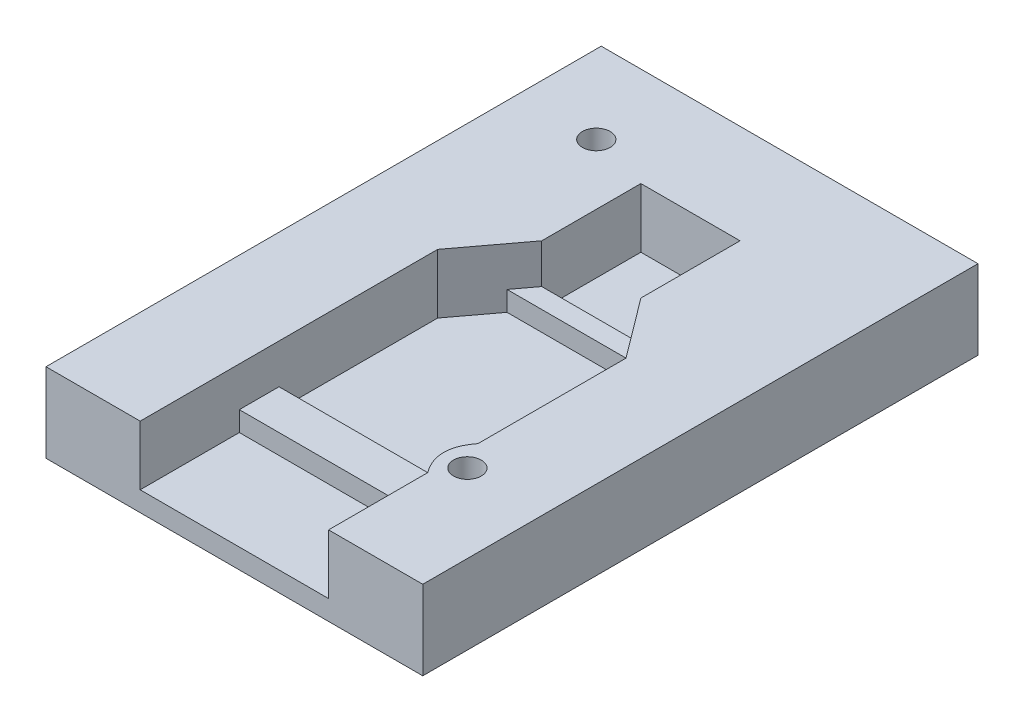
from build123d import *

# Parameters (mm, degrees)
SKETCH1_W           = 13.5
SKETCH1_H           = 20
BOSS_EXTRUDE1_DEPTH = 1
BOSS_EXTRUDE2_DEPTH = 3
BOSS_EXTRUDE3_DEPTH = 1
CUT_EXTRUDE1_START  = -1
SKETCH4_R           = 0.7
CUT_EXTRUDE1_DEPTH  = 11.5
SKETCH5_W           = 9.5
SKETCH5_H           = 2
BOSS_EXTRUDE4_DEPTH = 1
SKETCH6_W           = 19
SKETCH6_H           = 28
SKETCH6_W_2         = 13.5
SKETCH6_H_2         = 20
BOSS_EXTRUDE5_DEPTH = 1
BOSS_EXTRUDE6_DEPTH = 3


with BuildPart() as part:
    # Sketch1 → Boss-Extrude1 (new body)
    with BuildSketch(Plane(origin=(0, 0, 0), x_dir=(1, 0, 0), z_dir=(0, 1, 0))):
        with Locations((6.75, 10)):
            Rectangle(SKETCH1_W, SKETCH1_H)
    extrude(amount=BOSS_EXTRUDE1_DEPTH)

    # Sketch2 → Boss-Extrude2 (add)
    with BuildSketch(Plane(origin=(0, 1, 0), x_dir=(1, 0, 0), z_dir=(0, 1, 0))):
        with BuildLine():
            Line((2, 10), (2, 2))
            Line((2, 2), (2, 0))
            Line((2, 0), (0, 0))
            Line((0, 0), (0, 20))
            Line((0, 20), (13.5, 20))
            Line((13.5, 20), (13.5, 0))
            Line((13.5, 0), (11.5, 0))
            add(Edge.make_bspline(
                [(11.5, 2.535585729), (10.536627545, 1.300187459), (11.5, 0)],
                knots=[0, 0, 0, 1, 1, 1], degree=2))
            Line((11.5, 2.535585729), (11.5, 10))
            Line((11.5, 10), (9.25, 13))
            Line((9.25, 13), (9.25, 18))
            Line((9.25, 18), (4.25, 18))
            Line((4.25, 18), (4.25, 13))
            Line((4.25, 13), (2, 10))
        make_face()
    extrude(amount=BOSS_EXTRUDE2_DEPTH)

    # Sketch3 → Boss-Extrude3 (add)
    with BuildSketch(Plane(origin=(0, 1, 0), x_dir=(1, 0, 0), z_dir=(0, 1, 0))):
        Polygon((4.25, 13), (9.25, 13), (10, 12), (3.5, 12), align=None)
    extrude(amount=BOSS_EXTRUDE3_DEPTH)

    # Sketch4 → Cut-Extrude1 (cut)
    with BuildSketch(Plane.XZ.offset(CUT_EXTRUDE1_START)):
        with Locations(Location((1.2, -18.8, 0), (0, 0, 270))):
            Circle(SKETCH4_R)
        with Locations(Location((12.3, -1.2, 0), (0, 0, 270))):
            Circle(SKETCH4_R)
    extrude(amount=-CUT_EXTRUDE1_DEPTH, mode=Mode.SUBTRACT)

    # Sketch5 → Boss-Extrude4 (add)
    with BuildSketch(Plane(origin=(0, 1, 0), x_dir=(1, 0, 0), z_dir=(0, 1, 0))):
        with Locations((6.75, 1)):
            Rectangle(SKETCH5_W, SKETCH5_H)
    extrude(amount=BOSS_EXTRUDE4_DEPTH)

    # Sketch6 → Boss-Extrude5 (add)
    with BuildSketch(Plane(origin=(0, 1, 0), x_dir=(1, 0, 0), z_dir=(0, 1, 0))):
        with Locations((6.75, 9)):
            Rectangle(SKETCH6_W, SKETCH6_H)
        with Locations((6.75, 10)):
            Rectangle(SKETCH6_W_2, SKETCH6_H_2, mode=Mode.SUBTRACT)
    extrude(amount=-BOSS_EXTRUDE5_DEPTH)

    # Sketch7 → Boss-Extrude6 (add)
    with BuildSketch(Plane(origin=(0, 4, 0), x_dir=(1, 0, 0), z_dir=(0, 1, 0))):
        Polygon((2, 0), (2, -5), (-2.75, -5), (-2.75, 23), (16.25, 23), (16.25, -5), (11.5, -5), (11.5, 0), (13.5, 0), (13.5, 20), (0, 20), (0, 0), align=None)
    extrude(amount=-BOSS_EXTRUDE6_DEPTH)


solid = part.part
